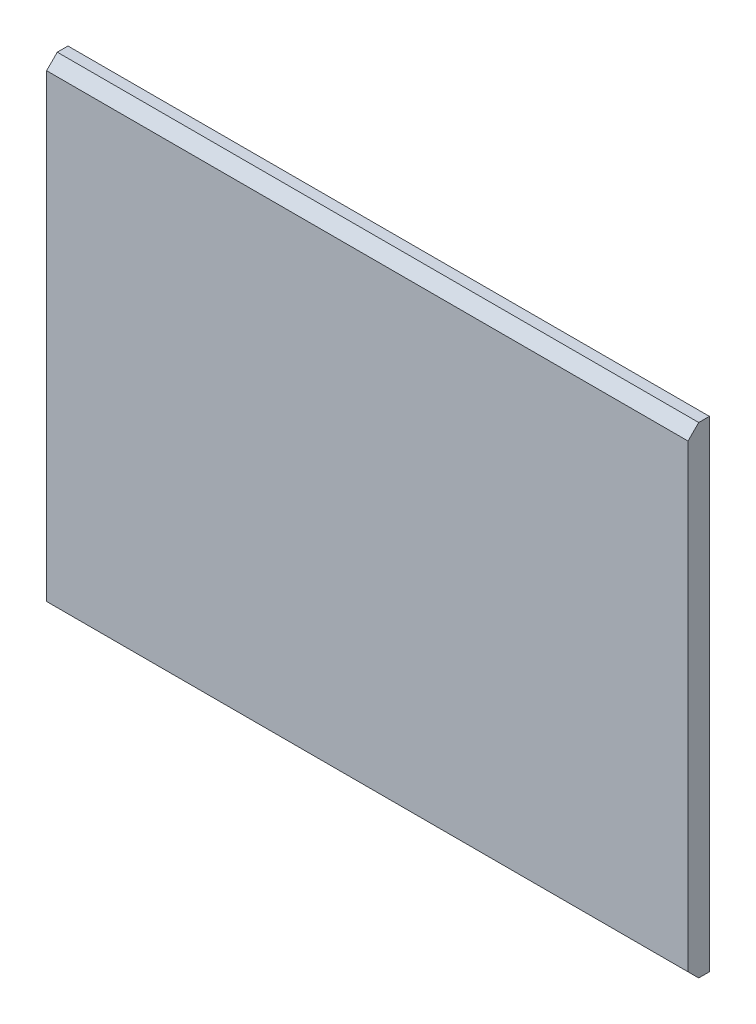
from build123d import *

# Parameters (mm, degrees)
SKETCH_1_W      = 300
SKETCH_1_H      = 225
EXTRUDE_1_DEPTH = 10
CHAMFER_1_SIZE  = 5


with BuildPart() as part:
    # 草图1 → 凸台-拉伸1 (new body)
    with BuildSketch(Plane.XY):
        Rectangle(SKETCH_1_W, SKETCH_1_H)
    extrude(amount=EXTRUDE_1_DEPTH)

    # 倒角1
    chamfer_1_edges = [part.edges().sort_by_distance(p)[0] for p in [
        (0, -112.5, 10),
        (0, 112.5, 10),
    ]]
    chamfer(chamfer_1_edges, length=CHAMFER_1_SIZE)


solid = part.part
